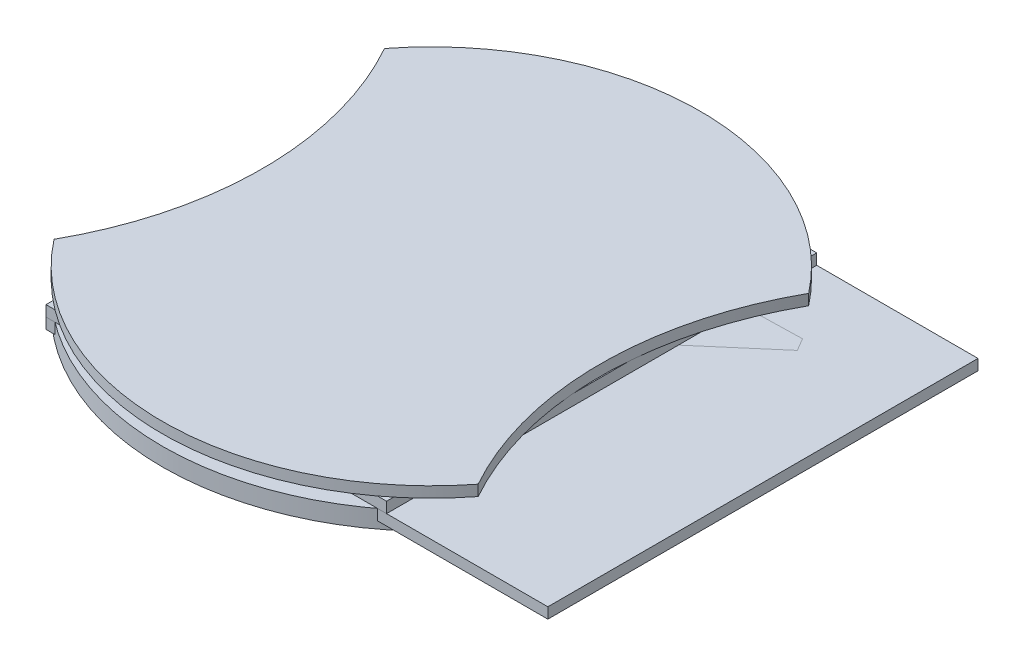
from build123d import *

# Parameters (mm, degrees)
SKETCH1_W                   = 140
SKETCH1_H                   = 120
COMPACT_DEPTH               = 3
SKETCH4_W                   = 95
SKETCH4_H                   = 120
SUPERCOMPACT_DEPTH          = 3
SKETCH7_R                   = 75
APPLE_BASE_DEPTH            = 3
SIDECUTS_DEPTH              = 195.694632694
APPLE_BASE_2_DEPTH          = 3
BOSS_EXTRUDE4_DEPTH         = 3
BASE_PLATE_FILLET_R         = 0.001
TOP_BOTTOM_EXTENSIONS_DEPTH = 3
SKETCH35_R                  = 1.25
SPACERHOLES_DEPTH           = 10
CUT_EXTRUDE4_DEPTH          = 10
SKETCH39_R                  = 75
SKETCH39_R_2                = 1.25
BOSS_EXTRUDE5_DEPTH         = 5
CUT_EXTRUDE5_DEPTH          = 150
SKETCH41_R                  = 8.4
CUT_EXTRUDE6_DEPTH          = 10
SKETCH44_R                  = 8.4
CUT_EXTRUDE7_DEPTH          = 10
SKETCH45_R                  = 1.5
CUT_EXTRUDE8_DEPTH          = 12
SKETCH46_R                  = 1.5
CUT_EXTRUDE9_DEPTH          = 10
CUT_EXTRUDE10_DEPTH         = 10
CUT_EXTRUDE11_DEPTH         = 10


with BuildPart() as part:
    # Sketch1 → Compact (new body)
    with BuildSketch(Plane(origin=(0, 0, 0), x_dir=(1, 0, 0), z_dir=(0, 1, 0))):
        with Locations((70, 60)):
            Rectangle(SKETCH1_W, SKETCH1_H)
    extrude(amount=COMPACT_DEPTH)


with BuildPart() as body_2:
    # Sketch4 → SuperCompact (new body)
    with BuildSketch(Plane(origin=(0, 3, 0), x_dir=(1, 0, 0), z_dir=(0, 1, 0))):
        with Locations((47.5, 60)):
            Rectangle(SKETCH4_W, SKETCH4_H)
    extrude(amount=SUPERCOMPACT_DEPTH)


with BuildPart() as body_3:
    # Sketch7 → Apple Base (new body)
    with BuildSketch(Plane(origin=(0, 6, 0), x_dir=(1, 0, 0), z_dir=(0, 1, 0))):
        with Locations(Location((47.5, 60, 0), (0, 0, 270))):
            Circle(SKETCH7_R)
    extrude(amount=APPLE_BASE_DEPTH)

    # Sketch8 → SideCuts (cut, through all)
    with BuildSketch(Plane(origin=(0, 9, 0), x_dir=(1, 0, 0), z_dir=(0, 1, 0))):
        with BuildLine():
            ThreePointArc((-11.66, 106.098746187), (0.350007958, 60), (-11.66, 13.901253813))
            ThreePointArc((-11.66, 13.901253813), (-27.5, 60), (-11.66, 106.098746187))
        make_face()
        with BuildLine():
            ThreePointArc((106.66, 106.098746187), (94.649992042, 60), (106.66, 13.901253813))
            ThreePointArc((106.66, 13.901253813), (122.5, 60), (106.66, 106.098746187))
        make_face()
    extrude(amount=-SIDECUTS_DEPTH, mode=Mode.SUBTRACT)


with BuildPart() as body_4:
    # Sketch9 → Apple_Base 2 (new body)
    with BuildSketch(Plane.XZ.offset(-6)):
        with BuildLine():
            ThreePointArc((106.66, -13.901253813), (47.5, 15), (-11.66, -13.901253813))
            ThreePointArc((-11.66, -13.901253813), (0.350007958, -60), (-11.66, -106.098746187))
            ThreePointArc((-11.66, -106.098746187), (47.5, -135), (106.66, -106.098746187))
            ThreePointArc((106.66, -106.098746187), (94.649992042, -60), (106.66, -13.901253813))
        make_face()
    extrude(amount=APPLE_BASE_2_DEPTH)

    # Sketch10 → Boss-Extrude4 (add)
    with BuildSketch(Plane(origin=(0, 6, 0), x_dir=(1, 0, 0), z_dir=(0, 1, 0))):
        with BuildLine():
            Line((-11.66, 106.098746187), (-11.66, 13.901253813))
            ThreePointArc((-11.66, 13.901253813), (0.350007958, 60), (-11.66, 106.098746187))
        make_face()
        with BuildLine():
            Line((106.66, 106.098746187), (106.66, 13.901253813))
            ThreePointArc((106.66, 13.901253813), (94.649992042, 60), (106.66, 106.098746187))
        make_face()
    extrude(amount=-BOSS_EXTRUDE4_DEPTH)

    # Base_Plate_Fillet
    base_plate_fillet_edges = [body_4.edges().sort_by_distance(p)[0] for p in [
        (-11.66, 3, -60),
        (-11.66, 6, -60),
        (47.5, 3, -135),
        (106.66, 3, -60),
        (106.66, 6, -60),
        (47.5, 6, -135),
        (47.5, 6, 15),
        (106.66, 4.5, -106.098746187),
        (-11.66, 4.5, -106.098746187),
        (-11.66, 4.5, -13.901253813),
        (106.66, 4.5, -13.901253813),
        (47.5, 3, 15),
    ]]
    fillet(base_plate_fillet_edges, radius=BASE_PLATE_FILLET_R)

    # Sketch25 → Top Bottom extensions (add)
    with BuildSketch(Plane(origin=(0, 6, 0), x_dir=(1, 0, 0), z_dir=(0, 1, 0))):
        with BuildLine():
            Line((-11.659005821, 106.097402592), (-11.659005821, 111.097402592))
            ThreePointArc((-11.659005821, 111.097402592), (47.5, 138.794628322), (106.659005821, 111.097402592))
            Line((106.659005821, 111.097402592), (106.659005821, 106.097402592))
            ThreePointArc((106.659005821, 106.097402592), (47.5, 133.794628322), (-11.659005821, 106.097402592))
        make_face()
        with BuildLine():
            Line((106.659005821, 13.902597408), (106.659005821, 8.902597408))
            ThreePointArc((106.659005821, 8.902597408), (47.5, -18.794628322), (-11.659005821, 8.902597408))
            Line((-11.659005821, 8.902597408), (-11.659005821, 13.902597408))
            ThreePointArc((-11.659005821, 13.902597408), (47.5, -13.794628322), (106.659005821, 13.902597408))
        make_face()
    extrude(amount=-TOP_BOTTOM_EXTENSIONS_DEPTH)

    # Sketch35 → SpacerHoles (cut)
    with BuildSketch(Plane.XZ.offset(-3)):
        with Locations(Location((7.5, -5.15, 0), (0, 0, 270))):
            Circle(SKETCH35_R)
        with Locations(Location((87.5, -5.15, 0), (0, 0, 270))):
            Circle(SKETCH35_R)
        with Locations(Location((87.5, -114.85, 0), (0, 0, 270))):
            Circle(SKETCH35_R)
        with Locations(Location((7.5, -114.85, 0), (0, 0, 270))):
            Circle(SKETCH35_R)
    extrude(amount=-SPACERHOLES_DEPTH, mode=Mode.SUBTRACT)

    # Sketch38 → Cut-Extrude4 (cut)
    with BuildSketch(Plane.XZ.offset(-3)):
        Polygon((47.5, 37.050137759), (120.372278362, 37.050137759), (120.372278362, -158.601845129), (-29.177494987, -158.601845129), (-29.177494987, 37.050137759), align=None)
        Polygon((-6.659, -60), (-6.659, 24.702355976), (101.659, 24.702355976), (101.659, -143.843523469), (-6.659, -143.843523469), align=None, mode=Mode.SUBTRACT)
    extrude(amount=-CUT_EXTRUDE4_DEPTH, mode=Mode.SUBTRACT)

    # Sketch39 → Boss-Extrude5 (add)
    with BuildSketch(Plane.XZ.offset(-3)):
        with Locations(Location((47.5, -60, 0), (0, 0, 43.770209918))):
            Circle(SKETCH39_R)
        with Locations(Location((87.5, -5.15, 0), (0, 0, 270))):
            Circle(SKETCH39_R_2, mode=Mode.SUBTRACT)
        with Locations(Location((7.5, -5.15, 0), (0, 0, 270))):
            Circle(SKETCH39_R_2, mode=Mode.SUBTRACT)
        with Locations(Location((7.5, -114.85, 0), (0, 0, 270))):
            Circle(SKETCH39_R_2, mode=Mode.SUBTRACT)
        with Locations(Location((87.5, -114.85, 0), (0, 0, 270))):
            Circle(SKETCH39_R_2, mode=Mode.SUBTRACT)
    extrude(amount=BOSS_EXTRUDE5_DEPTH)

    # Sketch40 → Cut-Extrude5 (cut)
    with BuildSketch(Plane(origin=(101.659, 0, 0), x_dir=(0, 0, -1), z_dir=(1, 0, 0))):
        Polygon((3.460058054, 3), (-22.733784582, 3), (-22.733784582, 8.214035789), (147.50303534, 8.214035789), (147.50303534, 3), align=None)
    extrude(amount=-CUT_EXTRUDE5_DEPTH, mode=Mode.SUBTRACT)

    # Sketch41 → Cut-Extrude6 (cut)
    with BuildSketch(Plane(origin=(0, 3, 0), x_dir=(1, 0, 0), z_dir=(0, 1, 0))):
        with Locations(Location((47.5, 60, 0), (0, 0, 270))):
            Circle(SKETCH41_R)
    extrude(amount=-CUT_EXTRUDE6_DEPTH, mode=Mode.SUBTRACT)

    # Sketch44 → Cut-Extrude7 (cut)
    with BuildSketch(Plane(origin=(0, 3, 0), x_dir=(1, 0, 0), z_dir=(0, 1, 0))):
        with Locations(Location((107.5, 60, 0), (0, 0, 270))):
            Circle(SKETCH44_R)
    extrude(amount=-CUT_EXTRUDE7_DEPTH, mode=Mode.SUBTRACT)

    # Sketch45 → Cut-Extrude8 (cut)
    with BuildSketch(Plane.XZ.offset(2)):
        with Locations(Location((76.961112303, -100.398550245, 0), (0, 0, 270))):
            Circle(SKETCH45_R)
        with Locations(Location((18.038887697, -100.398550245, 0), (0, 0, 270))):
            Circle(SKETCH45_R)
        with Locations(Location((18.038887697, -19.601449755, 0), (0, 0, 270))):
            Circle(SKETCH45_R)
    extrude(amount=-CUT_EXTRUDE8_DEPTH, mode=Mode.SUBTRACT)

    # Sketch46 → Cut-Extrude9 (cut)
    with BuildSketch(Plane.XZ.offset(2)):
        with Locations(Location((76.961112303, -19.601449755, 0), (0, 0, 270))):
            Circle(SKETCH46_R)
    extrude(amount=-CUT_EXTRUDE9_DEPTH, mode=Mode.SUBTRACT)

    # Sketch48 → Cut-Extrude10 (cut)
    with BuildSketch(Plane(origin=(0, 3, 0), x_dir=(1, 0, 0), z_dir=(0, 1, 0))):
        with BuildLine():
            Line((-2.5, 4.098300563), (-2.5, 60))
            Line((-2.5, 60), (-2.5, 115.901699437))
            ThreePointArc((-2.5, 115.901699437), (-27.5, 60), (-2.5, 4.098300563))
        make_face()
    extrude(amount=-CUT_EXTRUDE10_DEPTH, mode=Mode.SUBTRACT)

    # Sketch49 → Cut-Extrude11 (cut)
    with BuildSketch(Plane(origin=(0, 3, 0), x_dir=(1, 0, 0), z_dir=(0, 1, 0))):
        with BuildLine():
            Line((62.862291496, 118), (81.041019662, 118))
            ThreePointArc((81.041019662, 118), (47.5, 127), (13.958980338, 118))
            Line((13.958980338, 118), (32.137708504, 118))
            ThreePointArc((32.137708504, 118), (47.5, 120), (62.862291496, 118))
        make_face()
        with BuildLine():
            ThreePointArc((32.137708504, 2), (47.5, 0), (62.862291496, 2))
            Line((62.862291496, 2), (81.041019662, 2))
            ThreePointArc((81.041019662, 2), (47.5, -7), (13.958980338, 2))
            Line((13.958980338, 2), (32.137708504, 2))
        make_face()
    extrude(amount=-CUT_EXTRUDE11_DEPTH, mode=Mode.SUBTRACT)


solid = Compound([part.part, body_2.part, body_3.part, body_4.part])
